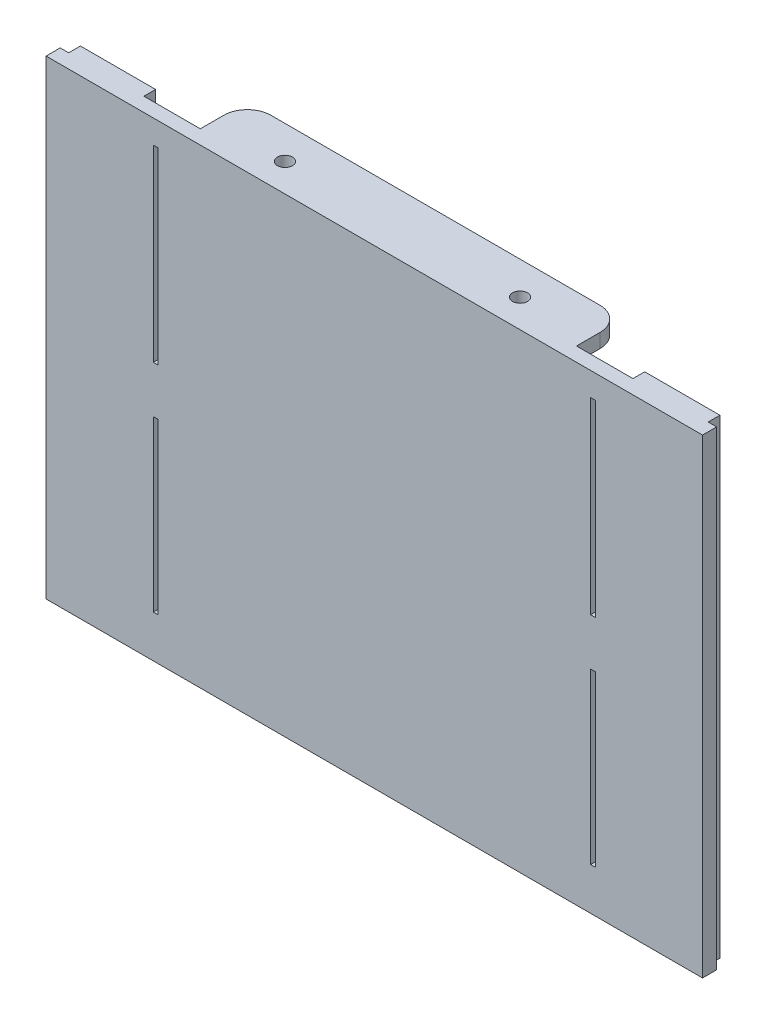
from build123d import *

# Parameters (mm, degrees)
SKETCH1_W                 = 140
SKETCH1_H                 = 100
BOSS_EXTRUDE1_DEPTH       = 3
SKETCH3_W                 = 16
SKETCH3_H                 = 100
BOSS_EXTRUDE2_DEPTH       = 2.5
SKETCH4_W                 = 12.2
SKETCH4_H                 = 5.5
CUT_EXTRUDE1_DEPTH        = 1.5
LPATTERN1_COUNT           = 4
LPATTERN1_PITCH           = 30
LPATTERN1_COPY_1_SKETCH_W = 12.2
LPATTERN1_COPY_1_SKETCH_H = 5.5
LPATTERN1_COPY_1_DEPTH    = 1.5
LPATTERN1_COPY_2_SKETCH_W = 12.2
LPATTERN1_COPY_2_SKETCH_H = 5.5
LPATTERN1_COPY_2_DEPTH    = 1.5
LPATTERN1_COPY_3_SKETCH_W = 12.2
LPATTERN1_COPY_3_SKETCH_H = 5.5
LPATTERN1_COPY_3_DEPTH    = 1.5
CUT_EXTRUDE3_DEPTH        = 123.102416029
CUT_EXTRUDE3_DEPTH_BACK   = 123.102416029
SKETCH6_W                 = 0.2
SKETCH6_H                 = 3
CUT_EXTRUDE5_DEPTH        = 1.5
LPATTERN2_COUNT           = 2
LPATTERN2_PITCH           = 30
LPATTERN2_COL_COUNT       = 2
LPATTERN2_COL_PITCH       = 30
MIRROR4_COPY_1_DEPTH      = 1.5
MIRROR4_COPY_2_DEPTH      = 1.5
SKETCH13_W                = 1
SKETCH13_H                = 40
SKETCH13_H_2              = 36
CUT_EXTRUDE7_DEPTH        = 10
SKETCH15_W                = 80
SKETCH15_H                = 3
BOSS_EXTRUDE4_DEPTH       = 10
FILLET2_R                 = 5
FILLET3_R                 = 3
SKETCH17_W                = 12.2
SKETCH17_H                = 2.25
CUT_EXTRUDE9_DEPTH        = 1.5
SKETCH18_R                = 1.6
CUT_EXTRUDE10_DEPTH       = 10


with BuildPart() as part:
    # Sketch1 → Boss-Extrude1 (new body)
    with BuildSketch(Plane.XY):
        Rectangle(SKETCH1_W, SKETCH1_H)
    extrude(amount=BOSS_EXTRUDE1_DEPTH)

    # Sketch3 → Boss-Extrude2 (add)
    with BuildSketch(Plane(origin=(0, 0, 0), x_dir=(-1, 0, 0), z_dir=(0, 0, -1))):
        with Locations((-60, 0)):
            Rectangle(SKETCH3_W, SKETCH3_H)
        with Locations((60, 0)):
            Rectangle(SKETCH3_W, SKETCH3_H)
    extrude(amount=BOSS_EXTRUDE2_DEPTH)

    # Sketch4 → Cut-Extrude1 (cut)
    with BuildSketch(Plane(origin=(0, 0, -2.5), x_dir=(-1, 0, 0), z_dir=(0, 0, -1))):
        with Locations((-60, 45)):
            Rectangle(SKETCH4_W, SKETCH4_H)
    cut_extrude1 = extrude(amount=-CUT_EXTRUDE1_DEPTH, mode=Mode.SUBTRACT)

    # Mirror1: Cut-Extrude1 across plane
    add(cut_extrude1.mirror(Plane(origin=(0, 0, 0), x_dir=(0, 0, 1), z_dir=(1, 0, 0))), mode=Mode.SUBTRACT)

    # LPattern1: Cut-Extrude1 ×4
    with Locations(*[(0, -i * LPATTERN1_PITCH, 0) for i in range(1, LPATTERN1_COUNT)]):
        add(cut_extrude1, mode=Mode.SUBTRACT)

    # LPattern1 copy 1 sketch → LPattern1 copy 1 (cut)
    with BuildSketch(Plane(origin=(0, -30, -2.5), x_dir=(1, 0, 0), z_dir=(0, 0, -1))):
        with Locations((-60, -45)):
            Rectangle(LPATTERN1_COPY_1_SKETCH_W, LPATTERN1_COPY_1_SKETCH_H)
    extrude(amount=-LPATTERN1_COPY_1_DEPTH, mode=Mode.SUBTRACT)

    # LPattern1 copy 2 sketch → LPattern1 copy 2 (cut)
    with BuildSketch(Plane(origin=(0, -60, -2.5), x_dir=(1, 0, 0), z_dir=(0, 0, -1))):
        with Locations((-60, -45)):
            Rectangle(LPATTERN1_COPY_2_SKETCH_W, LPATTERN1_COPY_2_SKETCH_H)
    extrude(amount=-LPATTERN1_COPY_2_DEPTH, mode=Mode.SUBTRACT)

    # LPattern1 copy 3 sketch → LPattern1 copy 3 (cut)
    with BuildSketch(Plane(origin=(0, -90, -2.5), x_dir=(1, 0, 0), z_dir=(0, 0, -1))):
        with Locations((-60, -45)):
            Rectangle(LPATTERN1_COPY_3_SKETCH_W, LPATTERN1_COPY_3_SKETCH_H)
    extrude(amount=-LPATTERN1_COPY_3_DEPTH, mode=Mode.SUBTRACT)

    # Sketch6 → Cut-Extrude3 (cut, two sides: drawn at the far end of the back side and taken through both)
    with BuildSketch(Plane(origin=(0, 50, 0), x_dir=(1, 0, 0), z_dir=(0, 1, 0)).offset(-CUT_EXTRUDE3_DEPTH_BACK)):
        with Locations((-69.9, -1.5)):
            Rectangle(SKETCH6_W, SKETCH6_H)
        with Locations((69.9, -1.5)):
            Rectangle(SKETCH6_W, SKETCH6_H)
    extrude(amount=CUT_EXTRUDE3_DEPTH + CUT_EXTRUDE3_DEPTH_BACK, mode=Mode.SUBTRACT)

    # Sketch11 → Cut-Extrude5 (cut)
    with BuildSketch(Plane(origin=(0, 0, -2.5), x_dir=(-1, 0, 0), z_dir=(0, 0, -1))):
        Polygon((-53.9, 12.25), (-60, -7.75), (-66.1, 12.25), align=None)
    cut_extrude5 = extrude(amount=-CUT_EXTRUDE5_DEPTH, mode=Mode.SUBTRACT)

    # LPattern2: Cut-Extrude5 ×2
    with Locations(*[(0, i * LPATTERN2_PITCH, 0) for i in range(1, LPATTERN2_COUNT)]):
        add(cut_extrude5, mode=Mode.SUBTRACT)

    # LPattern2 col: Cut-Extrude5 ×2
    with Locations(*[(0, -i * LPATTERN2_COL_PITCH, 0) for i in range(1, LPATTERN2_COL_COUNT)]):
        add(cut_extrude5, mode=Mode.SUBTRACT)

    # Mirror4: Cut-Extrude5 across plane
    add(cut_extrude5.mirror(Plane(origin=(0, 0, 0), x_dir=(0, 0, 1), z_dir=(1, 0, 0))), mode=Mode.SUBTRACT)

    # Mirror4 copy 1 sketch → Mirror4 copy 1 (cut)
    with BuildSketch(Plane(origin=(0, 30, -2.5), x_dir=(1, 0, 0), z_dir=(0, 0, -1))):
        Polygon((-53.9, -12.25), (-60, 7.75), (-66.1, -12.25), align=None)
    extrude(amount=-MIRROR4_COPY_1_DEPTH, mode=Mode.SUBTRACT)

    # Mirror4 copy 2 sketch → Mirror4 copy 2 (cut)
    with BuildSketch(Plane(origin=(0, -30, -2.5), x_dir=(1, 0, 0), z_dir=(0, 0, -1))):
        Polygon((-53.9, -12.25), (-60, 7.75), (-66.1, -12.25), align=None)
    extrude(amount=-MIRROR4_COPY_2_DEPTH, mode=Mode.SUBTRACT)

    # Sketch13 → Cut-Extrude7 (cut)
    with BuildSketch(Plane(origin=(0, 0, 0), x_dir=(-1, 0, 0), z_dir=(0, 0, -1))):
        with Locations((-46.5, 25)):
            Rectangle(SKETCH13_W, SKETCH13_H)
        with Locations((-46.5, -23)):
            Rectangle(SKETCH13_W, SKETCH13_H_2)
    cut_extrude7 = extrude(amount=-CUT_EXTRUDE7_DEPTH, mode=Mode.SUBTRACT)

    # Mirror7: Cut-Extrude7 across plane
    add(cut_extrude7.mirror(Plane(origin=(0, 0, 0), x_dir=(0, 0, 1), z_dir=(1, 0, 0))), mode=Mode.SUBTRACT)

    # Sketch15 → Boss-Extrude4 (add)
    with BuildSketch(Plane(origin=(0, 0, 0), x_dir=(-1, 0, 0), z_dir=(0, 0, -1))):
        with Locations((0, 48.5)):
            Rectangle(SKETCH15_W, SKETCH15_H)
    extrude(amount=BOSS_EXTRUDE4_DEPTH)

    # Fillet2
    fillet2_edges = [part.edges().sort_by_distance(p)[0] for p in [
        (40, 48.5, -10),
        (-40, 48.5, -10),
    ]]
    fillet(fillet2_edges, radius=FILLET2_R)

    # Fillet3
    fillet3_edges = [part.edges().sort_by_distance(p)[0] for p in [
        (0, 47, 0),
    ]]
    fillet(fillet3_edges, radius=FILLET3_R)

    # Sketch17 → Cut-Extrude9 (cut)
    with BuildSketch(Plane(origin=(0, 0, -2.5), x_dir=(-1, 0, 0), z_dir=(0, 0, -1))):
        with Locations((-60, -48.875)):
            Rectangle(SKETCH17_W, SKETCH17_H)
    cut_extrude9 = extrude(amount=-CUT_EXTRUDE9_DEPTH, mode=Mode.SUBTRACT)

    # Mirror8: Cut-Extrude9 across plane
    add(cut_extrude9.mirror(Plane(origin=(0, 0, 0), x_dir=(0, 0, 1), z_dir=(1, 0, 0))), mode=Mode.SUBTRACT)

    # Sketch18 → Cut-Extrude10 (cut)
    with BuildSketch(Plane(origin=(0, 50, 0), x_dir=(1, 0, 0), z_dir=(0, 1, 0))):
        with Locations(Location((-25, 3, 0), (0, 0, 180))):
            Circle(SKETCH18_R)
        with Locations(Location((25, 3, 0), (0, 0, 180))):
            Circle(SKETCH18_R)
    extrude(amount=-CUT_EXTRUDE10_DEPTH, mode=Mode.SUBTRACT)


solid = part.part
